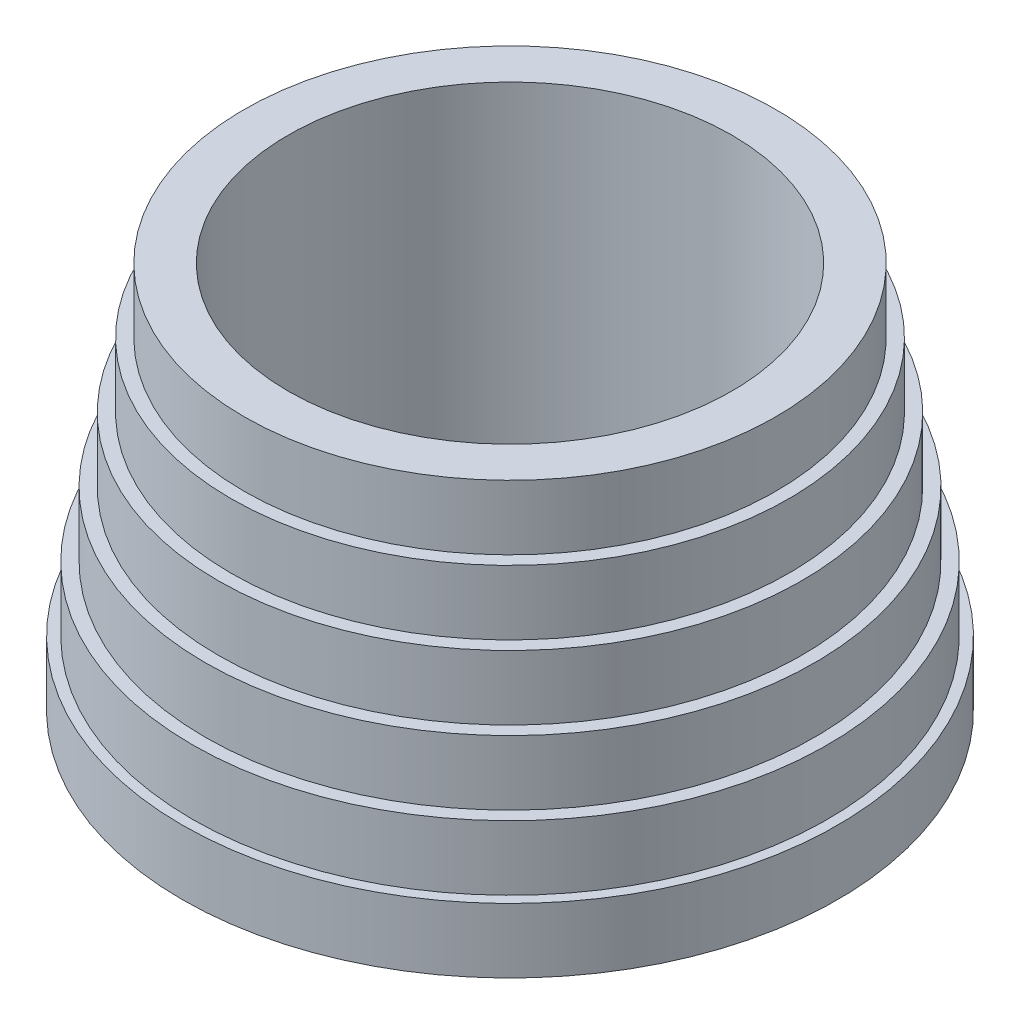
from build123d import *

# Parameters (mm, degrees)
SKETCH9_R           = 195.99424204
SKETCH9_R_2         = 171.779053358
BOSS_EXTRUDE1_DEPTH = 280.985470498
CHAMFER1_SIZE       = 10


with BuildPart() as part:
    # Sketch4 → Revolve3 (revolve)
    with BuildSketch(Plane.XY, mode=Mode.PRIVATE) as revolve3_sk:
        Polygon((-253.775337615, -190), (-245.99424204, -190), (-245.99424204, -150), (-235.99424204, -150), (-235.99424204, -100), (-225.99424204, -100), (-225.99424204, -50), (-215.99424204, -50), (-215.99424204, 0), (-205.99424204, 0), (-205.99424204, 50), (-195.99424204, 50), (-195.99424204, 110), (-205.99424204, 110), (-205.99424204, 60), (-215.99424204, 60), (-215.99424204, 10), (-225.99424204, 10), (-225.99424204, -40), (-235.99424204, -40), (-235.99424204, -90), (-245.99424204, -90), (-245.99424204, -140), (-253.775337615, -140), align=None)
    revolve(revolve3_sk.sketch.rotate(Axis((0, 105.494376543, 0), (0, -1, 0)), 270), axis=Axis((0, 105.494376543, 0), (0, -1, 0)))

    # Sketch9 → Boss-Extrude1 (add)
    with BuildSketch(Plane(origin=(0, 110, 0), x_dir=(1, 0, 0), z_dir=(0, 1, 0))):
        with Locations(Location((0, 0, 0), (0, 0, 270))):
            Circle(SKETCH9_R)
        with Locations(Location((0, 0, 0), (0, 0, 270))):
            Circle(SKETCH9_R_2, mode=Mode.SUBTRACT)
    extrude(amount=-BOSS_EXTRUDE1_DEPTH)

    # Chamfer1
    chamfer1_edges = [part.edges().sort_by_distance(p)[0] for p in [
        (0, -170.985470498, -195.99424204),
    ]]
    chamfer(chamfer1_edges, length=CHAMFER1_SIZE)


solid = part.part
